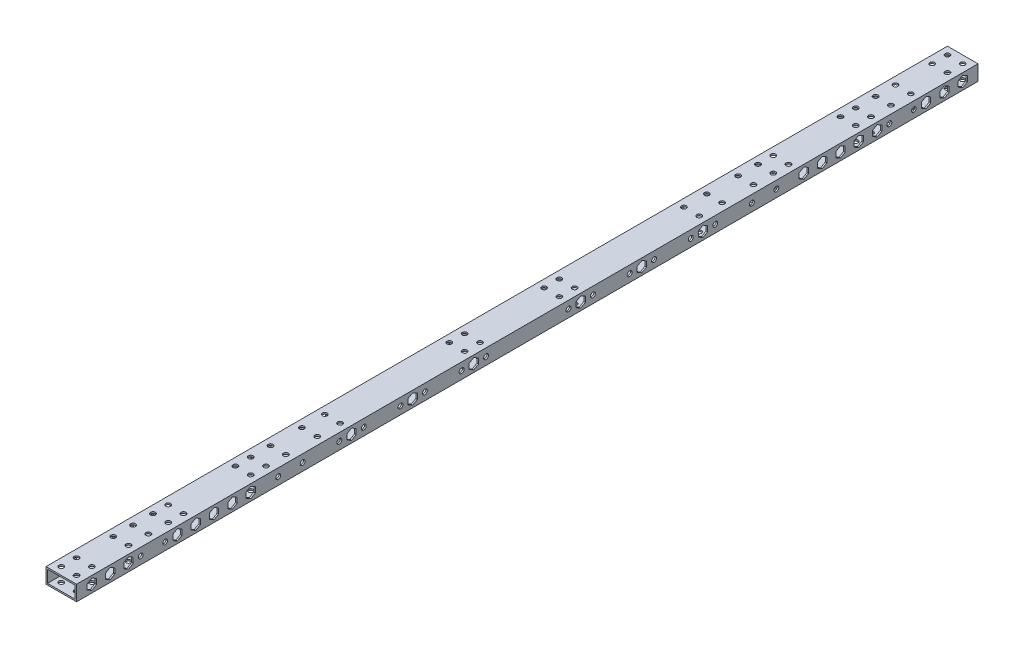
from build123d import *

# Parameters (mm, degrees)
SKETCH_1_W               = 20
SKETCH_1_H               = 10
SKETCH_1_W_2             = 18
SKETCH_1_H_2             = 8
EXTRUDE_1_DEPTH          = 590
SKETCH_2_R               = 1.575
SKETCH_2_R_2             = 1.6
CUT_EXTRUDE_1_DEPTH      = 591.423576765
CUT_EXTRUDE_2_DEPTH      = 591.423576765
CUT_EXTRUDE_2_DEPTH_BACK = 591.423576765
SKETCH_3_R               = 1.575
SKETCH_3_R_2             = 1.6


with BuildPart() as part:
    # 草图1 → 拉伸-薄壁1 (new body)
    with BuildSketch(Plane.XY):
        with Locations((10, -5)):
            Rectangle(SKETCH_1_W, SKETCH_1_H)
        with Locations((10, -5)):
            Rectangle(SKETCH_1_W_2, SKETCH_1_H_2, mode=Mode.SUBTRACT)
    extrude(amount=EXTRUDE_1_DEPTH)

    # 草图2 → 切除-拉伸1 (cut, through all)
    with BuildSketch(Plane(origin=(0, 0, 0), x_dir=(1, 0, 0), z_dir=(0, 1, 0))):
        with Locations(Location((5, -162.5, 0), (0, 0, 270))):
            Circle(SKETCH_2_R)
        with Locations(Location((15, -162.5, 0), (0, 0, 90))):
            Circle(SKETCH_2_R)
        with Locations(Location((15, -177.5, 0), (0, 0, 270))):
            Circle(SKETCH_2_R)
        with Locations(Location((5, -177.5, 0), (0, 0, 90))):
            Circle(SKETCH_2_R)
        with Locations(Location((5, -412.5, 0), (0, 0, 270))):
            Circle(SKETCH_2_R)
        with Locations(Location((15, -412.5, 0), (0, 0, 90))):
            Circle(SKETCH_2_R)
        with Locations(Location((15, -427.5, 0), (0, 0, 270))):
            Circle(SKETCH_2_R)
        with Locations(Location((5, -427.5, 0), (0, 0, 90))):
            Circle(SKETCH_2_R)
        with Locations(Location((5, -5, 0), (0, 0, 270))):
            Circle(SKETCH_2_R)
        with Locations(Location((15, -5, 0), (0, 0, 90))):
            Circle(SKETCH_2_R)
        with Locations(Location((15, -15, 0), (0, 0, 270))):
            Circle(SKETCH_2_R)
        with Locations(Location((5, -15, 0), (0, 0, 90))):
            Circle(SKETCH_2_R)
        with Locations(Location((5, -575, 0), (0, 0, 270))):
            Circle(SKETCH_2_R)
        with Locations(Location((15, -575, 0), (0, 0, 90))):
            Circle(SKETCH_2_R)
        with Locations(Location((15, -585, 0), (0, 0, 270))):
            Circle(SKETCH_2_R)
        with Locations(Location((5, -585, 0), (0, 0, 90))):
            Circle(SKETCH_2_R)
        with Locations(Location((5, -259, 0), (0, 0, 270))):
            Circle(SKETCH_2_R)
        with Locations(Location((15, -259, 0), (0, 0, 90))):
            Circle(SKETCH_2_R)
        with Locations(Location((15, -269, 0), (0, 0, 270))):
            Circle(SKETCH_2_R)
        with Locations(Location((5, -269, 0), (0, 0, 90))):
            Circle(SKETCH_2_R)
        with Locations(Location((5, -321, 0), (0, 0, 270))):
            Circle(SKETCH_2_R)
        with Locations(Location((15, -321, 0), (0, 0, 90))):
            Circle(SKETCH_2_R)
        with Locations(Location((15, -331, 0), (0, 0, 270))):
            Circle(SKETCH_2_R)
        with Locations(Location((5, -331, 0), (0, 0, 90))):
            Circle(SKETCH_2_R)
        with Locations(Location((15, -39, 0), (0, 0, 270))):
            Circle(SKETCH_2_R_2)
        with Locations(Location((5, -39, 0), (0, 0, 90))):
            Circle(SKETCH_2_R_2)
        with Locations(Location((5, -52, 0), (0, 0, 270))):
            Circle(SKETCH_2_R_2)
        with Locations(Location((15, -52, 0), (0, 0, 90))):
            Circle(SKETCH_2_R_2)
        with Locations(Location((15, -142, 0), (0, 0, 270))):
            Circle(SKETCH_2_R_2)
        with Locations(Location((5, -142, 0), (0, 0, 90))):
            Circle(SKETCH_2_R_2)
        with Locations(Location((5, -65, 0), (0, 0, 270))):
            Circle(SKETCH_2_R_2)
        with Locations(Location((15, -65, 0), (0, 0, 90))):
            Circle(SKETCH_2_R_2)
        with Locations(Location((15, -75, 0), (0, 0, 270))):
            Circle(SKETCH_2_R_2)
        with Locations(Location((5, -75, 0), (0, 0, 90))):
            Circle(SKETCH_2_R_2)
        with Locations(Location((5, -119, 0), (0, 0, 270))):
            Circle(SKETCH_2_R_2)
        with Locations(Location((15, -119, 0), (0, 0, 90))):
            Circle(SKETCH_2_R_2)
        with Locations(Location((15, -129, 0), (0, 0, 270))):
            Circle(SKETCH_2_R_2)
        with Locations(Location((5, -129, 0), (0, 0, 90))):
            Circle(SKETCH_2_R_2)
        with Locations(Location((5, -461, 0), (0, 0, 270))):
            Circle(SKETCH_2_R_2)
        with Locations(Location((15, -461, 0), (0, 0, 90))):
            Circle(SKETCH_2_R_2)
        with Locations(Location((15, -471, 0), (0, 0, 270))):
            Circle(SKETCH_2_R_2)
        with Locations(Location((5, -471, 0), (0, 0, 90))):
            Circle(SKETCH_2_R_2)
        with Locations(Location((5, -515, 0), (0, 0, 270))):
            Circle(SKETCH_2_R_2)
        with Locations(Location((15, -515, 0), (0, 0, 90))):
            Circle(SKETCH_2_R_2)
        with Locations(Location((15, -525, 0), (0, 0, 270))):
            Circle(SKETCH_2_R_2)
        with Locations(Location((5, -525, 0), (0, 0, 90))):
            Circle(SKETCH_2_R_2)
        with Locations(Location((5, -448, 0), (0, 0, 270))):
            Circle(SKETCH_2_R_2)
        with Locations(Location((15, -448, 0), (0, 0, 90))):
            Circle(SKETCH_2_R_2)
        with Locations(Location((15, -538, 0), (0, 0, 270))):
            Circle(SKETCH_2_R_2)
        with Locations(Location((5, -538, 0), (0, 0, 90))):
            Circle(SKETCH_2_R_2)
        with Locations(Location((5, -551, 0), (0, 0, 270))):
            Circle(SKETCH_2_R_2)
        with Locations(Location((15, -551, 0), (0, 0, 90))):
            Circle(SKETCH_2_R_2)
    extrude(amount=-CUT_EXTRUDE_1_DEPTH, mode=Mode.SUBTRACT)

    # 草图3 → 切除-拉伸2 (cut, two sides: drawn at the far end of the back side and taken through both)
    with BuildSketch(Plane.ZY.offset(-CUT_EXTRUDE_2_DEPTH_BACK)):
        with Locations(Location((548, -5, 0), (0, 0, 270))):
            Circle(SKETCH_3_R)
        with Locations((532, -5)):
            Circle(SKETCH_3_R)
        with Locations(Location((458, -5, 0), (0, 0, 270))):
            Circle(SKETCH_3_R_2)
        with Locations((442, -5)):
            Circle(SKETCH_3_R_2)
        with Locations(Location((148, -5, 0), (0, 0, 270))):
            Circle(SKETCH_3_R_2)
        with Locations((132, -5)):
            Circle(SKETCH_3_R_2)
        with Locations(Location((58, -5, 0), (0, 0, 270))):
            Circle(SKETCH_3_R)
        with Locations((42, -5)):
            Circle(SKETCH_3_R)
        with Locations((402, -5)):
            Circle(SKETCH_3_R_2)
        with Locations(Location((418, -5, 0), (0, 0, 270))):
            Circle(SKETCH_3_R_2)
        with Locations((362, -5)):
            Circle(SKETCH_3_R_2)
        with Locations(Location((378, -5, 0), (0, 0, 270))):
            Circle(SKETCH_3_R_2)
        with Locations((322, -5)):
            Circle(SKETCH_3_R_2)
        with Locations(Location((338, -5, 0), (0, 0, 270))):
            Circle(SKETCH_3_R_2)
        with Locations((252, -5)):
            Circle(SKETCH_3_R_2)
        with Locations(Location((268, -5, 0), (0, 0, 270))):
            Circle(SKETCH_3_R_2)
        with Locations((212, -5)):
            Circle(SKETCH_3_R_2)
        with Locations(Location((228, -5, 0), (0, 0, 270))):
            Circle(SKETCH_3_R_2)
        with Locations((172, -5)):
            Circle(SKETCH_3_R_2)
        with Locations(Location((188, -5, 0), (0, 0, 270))):
            Circle(SKETCH_3_R_2)
        Polygon((22, -1.5), (18.968911087, -3.25), (18.968911087, -6.75), (22, -8.5), (25.031088913, -6.75), (25.031088913, -3.25), align=None)
        Polygon((10, -1.5), (6.968911087, -3.25), (6.968911087, -6.75), (10, -8.5), (13.031088913, -6.75), (13.031088913, -3.25), align=None)
        Polygon((34, -1.5), (30.968911087, -3.25), (30.968911087, -6.75), (34, -8.5), (37.031088913, -6.75), (37.031088913, -3.25), align=None)
        Polygon((66, -8.5), (62.968911087, -6.75), (62.968911087, -3.25), (66, -1.5), (69.031088913, -3.25), (69.031088913, -6.75), align=None)
        Polygon((78, -8.5), (74.968911087, -6.75), (74.968911087, -3.25), (78, -1.5), (81.031088913, -3.25), (81.031088913, -6.75), align=None)
        Polygon((86.968911087, -3.25), (90, -1.5), (93.031088913, -3.25), (93.031088913, -6.75), (90, -8.5), (86.968911087, -6.75), align=None)
        Polygon((98.968911087, -3.25), (102, -1.5), (105.031088913, -3.25), (105.031088913, -6.75), (102, -8.5), (98.968911087, -6.75), align=None)
        Polygon((110.968911087, -3.25), (114, -1.5), (117.031088913, -3.25), (117.031088913, -6.75), (114, -8.5), (110.968911087, -6.75), align=None)
        Polygon((479.031088913, -6.75), (479.031088913, -3.25), (476, -1.5), (472.968911087, -3.25), (472.968911087, -6.75), (476, -8.5), align=None)
        Polygon((491.031088913, -6.75), (491.031088913, -3.25), (488, -1.5), (484.968911087, -3.25), (484.968911087, -6.75), (488, -8.5), align=None)
        Polygon((512, -1.5), (508.968911087, -3.25), (508.968911087, -6.75), (512, -8.5), (515.031088913, -6.75), (515.031088913, -3.25), align=None)
        Polygon((500, -1.5), (496.968911087, -3.25), (496.968911087, -6.75), (500, -8.5), (503.031088913, -6.75), (503.031088913, -3.25), align=None)
        Polygon((524, -1.5), (520.968911087, -3.25), (520.968911087, -6.75), (524, -8.5), (527.031088913, -6.75), (527.031088913, -3.25), align=None)
        Polygon((556, -8.5), (552.968911087, -6.75), (552.968911087, -3.25), (556, -1.5), (559.031088913, -3.25), (559.031088913, -6.75), align=None)
        Polygon((568, -8.5), (564.968911087, -6.75), (564.968911087, -3.25), (568, -1.5), (571.031088913, -3.25), (571.031088913, -6.75), align=None)
        Polygon((576.968911087, -3.25), (580, -1.5), (583.031088913, -3.25), (583.031088913, -6.75), (580, -8.5), (576.968911087, -6.75), align=None)
        Polygon((220, -1.5), (216.968911087, -3.25), (216.968911087, -6.75), (220, -8.5), (223.031088913, -6.75), (223.031088913, -3.25), align=None)
        Polygon((180, -1.5), (176.968911087, -3.25), (176.968911087, -6.75), (180, -8.5), (183.031088913, -6.75), (183.031088913, -3.25), align=None)
        Polygon((260, -1.5), (256.968911087, -3.25), (256.968911087, -6.75), (260, -8.5), (263.031088913, -6.75), (263.031088913, -3.25), align=None)
        Polygon((406.968911087, -3.25), (410, -1.5), (413.031088913, -3.25), (413.031088913, -6.75), (410, -8.5), (406.968911087, -6.75), align=None)
        Polygon((333.031088913, -3.25), (333.031088913, -6.75), (330, -8.5), (326.968911087, -6.75), (326.968911087, -3.25), (330, -1.5), align=None)
        Polygon((373.031088913, -3.25), (373.031088913, -6.75), (370, -8.5), (366.968911087, -6.75), (366.968911087, -3.25), (370, -1.5), align=None)
    extrude(amount=CUT_EXTRUDE_2_DEPTH + CUT_EXTRUDE_2_DEPTH_BACK, mode=Mode.SUBTRACT)


solid = part.part
